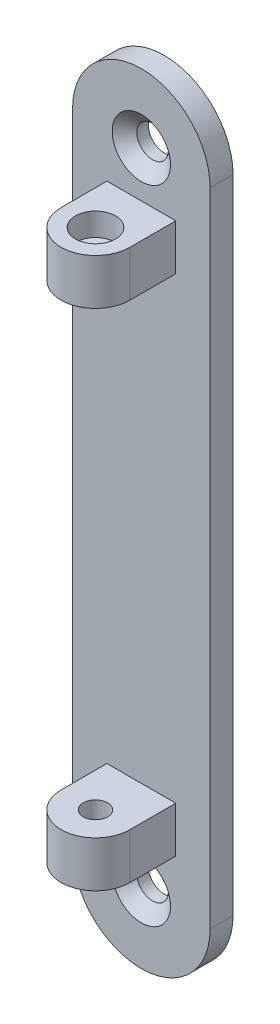
from build123d import *

# Parameters (mm, degrees)
BOSS_EXTRUDE1_DEPTH                              = 6.35
SKETCH6_W                                        = 19.05
SKETCH6_H                                        = 12.7
BOSS_EXTRUDE4_DEPTH                              = 12.7
BOSS_EXTRUDE7_DEPTH                              = 12.7
CBORE_FOR_1_4_SOCKET_HEAD_CAP_SCREW1_D           = 6.7564
CBORE_FOR_1_4_SOCKET_HEAD_CAP_SCREW1_CBORE_D     = 11.1125
CBORE_FOR_1_4_SOCKET_HEAD_CAP_SCREW1_CBORE_DEPTH = 6.35


with BuildPart() as part:
    # Sketch1 → Boss-Extrude1 (new body)
    with BuildSketch(Plane.XY):
        with BuildLine():
            Line((0, 0), (0, 88.9))
            ThreePointArc((0, 88.9), (19.05, 107.95), (38.1, 88.9))
            Line((38.1, 88.9), (38.1, 0))
            Line((38.1, 0), (0, 0))
        make_face()
    extrude(amount=BOSS_EXTRUDE1_DEPTH)

    # Sketch5 → CSK for 5/16 Flat Head Machine Screw (100)1 (revolve, cut)
    with BuildSketch(Plane(origin=(19.05, 88.9, 6.35), x_dir=(0, -1, 0), z_dir=(1, 0, 0))):
        Polygon((0, 0), (0, 6.35), (4.36499, 6.35), (4.36499, 3.104257477), (8.0645, 0), align=None)
    revolve(axis=Axis((19.05, 88.9, 12.7), (0, 0, -1)), mode=Mode.SUBTRACT)

    # Sketch6 → Boss-Extrude4 (add)
    with BuildSketch(Plane.XY.offset(6.35)):
        with Locations((19.05, 69.85)):
            Rectangle(SKETCH6_W, SKETCH6_H)
    extrude(amount=BOSS_EXTRUDE4_DEPTH)

    # Sketch12 → Boss-Extrude7 (add)
    with BuildSketch(Plane(origin=(0, 76.2, 0), x_dir=(1, 0, 0), z_dir=(0, 1, 0))):
        with BuildLine():
            Line((9.525, -19.05), (28.575, -19.05))
            ThreePointArc((28.575, -19.05), (19.05, -28.575), (9.525, -19.05))
        make_face()
    extrude(amount=-BOSS_EXTRUDE7_DEPTH)

    # CBORE for 1/4 Socket Head Cap Screw1 (through all)
    with Locations(Plane(origin=(0, 76.2, 0), x_dir=(1, 0, 0), z_dir=(0, 1, 0))):
        with Locations((19.05, -19.05)):
            CounterBoreHole(CBORE_FOR_1_4_SOCKET_HEAD_CAP_SCREW1_D / 2, CBORE_FOR_1_4_SOCKET_HEAD_CAP_SCREW1_CBORE_D / 2, CBORE_FOR_1_4_SOCKET_HEAD_CAP_SCREW1_CBORE_DEPTH)

    # Mirror1: part across plane


with BuildPart() as part_1:
    add(part.part)
    add(part.part.mirror(Plane(origin=(38.1, 0, 6.35), x_dir=(0, 0, 1), z_dir=(0, 1, 0))))


solid = part_1.part
